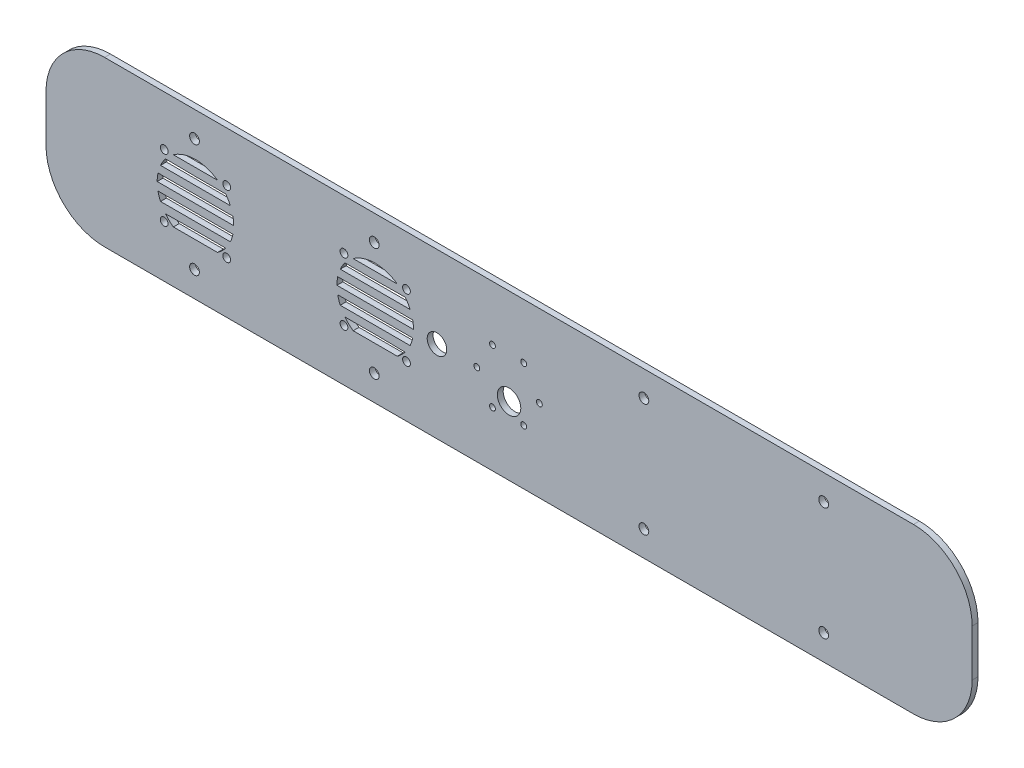
from build123d import *

# Parameters (mm, degrees)
CROQUIS1_R              = 1.5
CROQUIS1_R_2            = 6
SALIENTE_EXTRUIR1_DEPTH = 3
CROQUIS3_R              = 2
CORTAR_EXTRUIR1_DEPTH   = 10
CROQUIS4_R              = 5
CORTAR_EXTRUIR2_DEPTH   = 5
CROQUIS5_R              = 2.5
CORTAR_EXTRUIR3_DEPTH   = 10


with BuildPart() as part:
    # Croquis1 → Saliente-Extruir1 (new body)
    with BuildSketch(Plane.XY):
        with BuildLine():
            Line((207, -38), (-207, -38))
            ThreePointArc((-207, -38), (-228.213203436, -29.213203436), (-237, -8))
            Line((-237, -8), (-237, 16))
            ThreePointArc((-237, 16), (-228.213203436, 37.213203436), (-207, 46))
            Line((-207, 46), (207, 46))
            ThreePointArc((207, 46), (228.213203436, 37.213203436), (237, 16))
            Line((237, 16), (237, -8))
            ThreePointArc((237, -8), (228.213203436, -29.213203436), (207, -38))
        make_face()
        with Locations((15.5, 4)):
            Circle(CROQUIS1_R, mode=Mode.SUBTRACT)
        with Locations((7.496094703, -9.863170633)):
            Circle(CROQUIS1_R, mode=Mode.SUBTRACT)
        with Locations((-8.51171589, -9.863170633)):
            Circle(CROQUIS1_R, mode=Mode.SUBTRACT)
        with Locations((-16.515621187, 4)):
            Circle(CROQUIS1_R, mode=Mode.SUBTRACT)
        with Locations((-8.51171589, 17.863170633)):
            Circle(CROQUIS1_R, mode=Mode.SUBTRACT)
        with Locations((7.496094703, 17.863170633)):
            Circle(CROQUIS1_R, mode=Mode.SUBTRACT)
        with Locations((0, -3)):
            Circle(CROQUIS1_R_2, mode=Mode.SUBTRACT)
    extrude(amount=SALIENTE_EXTRUIR1_DEPTH)

    # Croquis3 → Cortar-Extruir1 (cut)
    with BuildSketch(Plane.XY.offset(3)):
        with Locations((-176.510078636, 20.458426503)):
            Circle(CROQUIS3_R)
        with Locations((-144.510078636, 20.458426503)):
            Circle(CROQUIS3_R)
        with Locations((-176.510078636, -11.541573497)):
            Circle(CROQUIS3_R)
        with Locations((-144.510078636, -11.541573497)):
            Circle(CROQUIS3_R)
        with Locations((-84.510078636, -11.541573497)):
            Circle(CROQUIS3_R)
        with Locations((-52.510078636, -11.541573497)):
            Circle(CROQUIS3_R)
        with Locations((-84.510078636, 20.458426503)):
            Circle(CROQUIS3_R)
        with Locations((-52.510078636, 20.458426503)):
            Circle(CROQUIS3_R)
        with BuildLine():
            Line((-171.81353386, -11.541573497), (-149.206623412, -11.541573497))
            ThreePointArc((-149.206623412, -11.541573497), (-146.967629564, -9.696790667), (-145.025631601, -7.541573497))
            Line((-145.025631601, -7.541573497), (-160.510078636, -7.541573497))
            Line((-160.510078636, -7.541573497), (-175.850570995, -7.725062086))
            ThreePointArc((-175.850570995, -7.725062086), (-173.968028908, -9.777151268), (-171.81353386, -11.541573497))
        make_face()
        with BuildLine():
            Line((-160.510078636, 8.458426503), (-141.332797807, 8.458426503))
            ThreePointArc((-141.332797807, 8.458426503), (-141.023531592, 6.469044388), (-140.920078636, 4.458426503))
            Line((-140.920078636, 4.458426503), (-180.100078636, 4.458426503))
            ThreePointArc((-180.100078636, 4.458426503), (-179.996625681, 6.469044388), (-179.687359465, 8.458426503))
            Line((-179.687359465, 8.458426503), (-160.510078636, 8.458426503))
        make_face()
        with BuildLine():
            Line((-160.510078636, 12.458426503), (-142.628017793, 12.458426503))
            ThreePointArc((-142.628017793, 12.458426503), (-143.707371652, 14.53002707), (-145.025631601, 16.458426503))
            Line((-145.025631601, 16.458426503), (-160.510078636, 16.458426503))
            Line((-160.510078636, 16.458426503), (-175.850570995, 16.641915092))
            ThreePointArc((-175.850570995, 16.641915092), (-177.252536774, 14.629866691), (-178.392139479, 12.458426503))
            Line((-178.392139479, 12.458426503), (-160.510078636, 12.458426503))
        make_face()
        with BuildLine():
            Line((-160.510078636, 0.458426503), (-141.332797807, 0.458426503))
            ThreePointArc((-141.332797807, 0.458426503), (-141.872785343, -1.576422186), (-142.628017793, -3.541573497))
            Line((-142.628017793, -3.541573497), (-160.510078636, -3.541573497))
            Line((-160.510078636, -3.541573497), (-178.392139479, -3.541573497))
            ThreePointArc((-178.392139479, -3.541573497), (-179.147371929, -1.576422186), (-179.687359465, 0.458426503))
            Line((-179.687359465, 0.458426503), (-160.510078636, 0.458426503))
        make_face()
        with BuildLine():
            Line((-171.81353386, 20.458426503), (-149.206623412, 20.458426503))
            ThreePointArc((-149.206623412, 20.458426503), (-160.510078636, 24.048426503), (-171.81353386, 20.458426503))
        make_face()
        with BuildLine():
            Line((-57.206623412, 20.458426503), (-79.81353386, 20.458426503))
            ThreePointArc((-79.81353386, 20.458426503), (-68.510078636, 24.048426503), (-57.206623412, 20.458426503))
        make_face()
        with BuildLine():
            Line((-68.510078636, -7.541573497), (-53.169586278, -7.725062086))
            ThreePointArc((-53.169586278, -7.725062086), (-55.052128364, -9.777151268), (-57.206623412, -11.541573497))
            Line((-57.206623412, -11.541573497), (-79.81353386, -11.541573497))
            ThreePointArc((-79.81353386, -11.541573497), (-82.052527708, -9.696790667), (-83.994525672, -7.541573497))
            Line((-83.994525672, -7.541573497), (-68.510078636, -7.541573497))
        make_face()
        with BuildLine():
            Line((-68.510078636, -3.541573497), (-50.628017793, -3.541573497))
            ThreePointArc((-50.628017793, -3.541573497), (-49.872785343, -1.576422186), (-49.332797807, 0.458426503))
            Line((-49.332797807, 0.458426503), (-68.510078636, 0.458426503))
            Line((-68.510078636, 0.458426503), (-87.687359465, 0.458426503))
            ThreePointArc((-87.687359465, 0.458426503), (-87.147371929, -1.576422186), (-86.392139479, -3.541573497))
            Line((-86.392139479, -3.541573497), (-68.510078636, -3.541573497))
        make_face()
        with BuildLine():
            Line((-68.510078636, 16.458426503), (-53.169586278, 16.641915092))
            ThreePointArc((-53.169586278, 16.641915092), (-51.767620498, 14.629866691), (-50.628017793, 12.458426503))
            Line((-50.628017793, 12.458426503), (-68.510078636, 12.458426503))
            Line((-68.510078636, 12.458426503), (-86.392139479, 12.458426503))
            ThreePointArc((-86.392139479, 12.458426503), (-85.312785621, 14.53002707), (-83.994525672, 16.458426503))
            Line((-83.994525672, 16.458426503), (-68.510078636, 16.458426503))
        make_face()
        with BuildLine():
            Line((-68.510078636, 8.458426503), (-49.332797807, 8.458426503))
            ThreePointArc((-49.332797807, 8.458426503), (-49.023531592, 6.469044388), (-48.920078636, 4.458426503))
            Line((-48.920078636, 4.458426503), (-88.100078636, 4.458426503))
            ThreePointArc((-88.100078636, 4.458426503), (-87.996625681, 6.469044388), (-87.687359465, 8.458426503))
            Line((-87.687359465, 8.458426503), (-68.510078636, 8.458426503))
        make_face()
    extrude(amount=-CORTAR_EXTRUIR1_DEPTH, mode=Mode.SUBTRACT)

    # Croquis4 → Cortar-Extruir2 (cut)
    with BuildSketch(Plane.XY.offset(3)):
        with Locations((-36.9, 4)):
            Circle(CROQUIS4_R)
    extrude(amount=-CORTAR_EXTRUIR2_DEPTH, mode=Mode.SUBTRACT)

    # Croquis5 → Cortar-Extruir3 (cut)
    with BuildSketch(Plane(origin=(0, 0, 0), x_dir=(-1, 0, 0), z_dir=(0, 0, -1))):
        with Locations((69, 33)):
            Circle(CROQUIS5_R)
        with Locations((161, 33)):
            Circle(CROQUIS5_R)
        with Locations(Location((161, -25, 0), (0, 0, 180))):
            Circle(CROQUIS5_R)
        with Locations(Location((69, -25, 0), (0, 0, 180))):
            Circle(CROQUIS5_R)
        with Locations((-69, -25)):
            Circle(CROQUIS5_R)
        with Locations((-161, -25)):
            Circle(CROQUIS5_R)
        with Locations(Location((-161, 33, 0), (0, 0, 180))):
            Circle(CROQUIS5_R)
        with Locations(Location((-69, 33, 0), (0, 0, 180))):
            Circle(CROQUIS5_R)
    extrude(amount=-CORTAR_EXTRUIR3_DEPTH, mode=Mode.SUBTRACT)


solid = part.part
